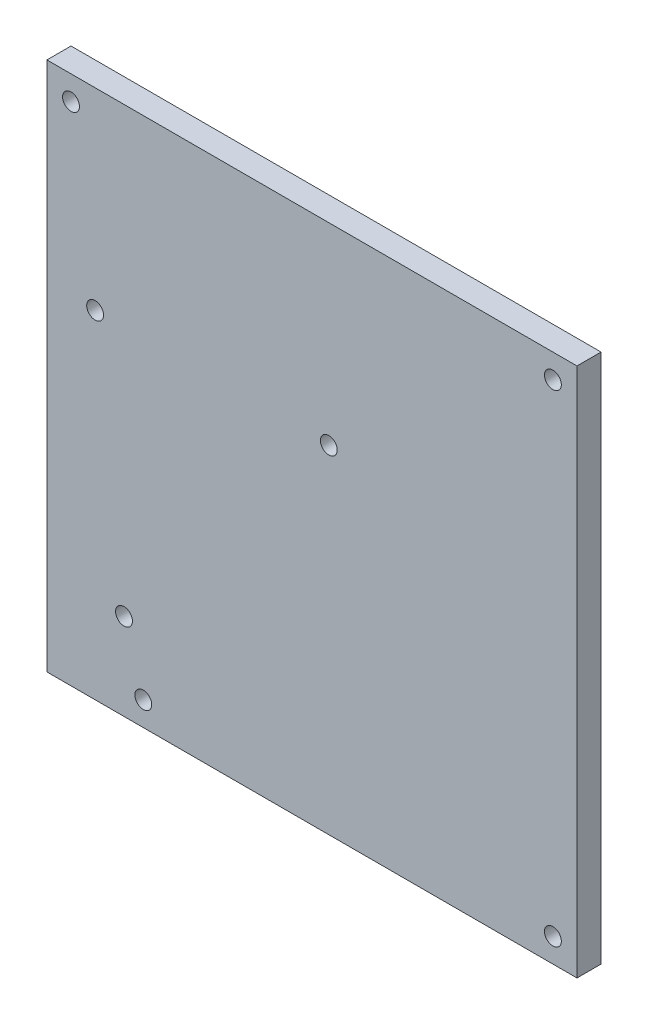
from build123d import *

# Parameters (mm, degrees)
SKETCH_1_W      = 110
SKETCH_1_H      = 110
SKETCH_1_R      = 1.75
EXTRUDE_1_DEPTH = 5


with BuildPart() as part:
    # 草图1 → 凸台-拉伸1 (new body)
    with BuildSketch(Plane.XY):
        with Locations((55, -55)):
            Rectangle(SKETCH_1_W, SKETCH_1_H)
        with Locations((5, -5)):
            Circle(SKETCH_1_R, mode=Mode.SUBTRACT)
        with Locations((105, -5)):
            Circle(SKETCH_1_R, mode=Mode.SUBTRACT)
        with Locations((20, -105)):
            Circle(SKETCH_1_R, mode=Mode.SUBTRACT)
        with Locations((105, -105)):
            Circle(SKETCH_1_R, mode=Mode.SUBTRACT)
        with Locations((10, -40)):
            Circle(SKETCH_1_R, mode=Mode.SUBTRACT)
        with Locations((58.5, -40)):
            Circle(SKETCH_1_R, mode=Mode.SUBTRACT)
        with Locations((16, -92)):
            Circle(SKETCH_1_R, mode=Mode.SUBTRACT)
    extrude(amount=EXTRUDE_1_DEPTH)


solid = part.part
